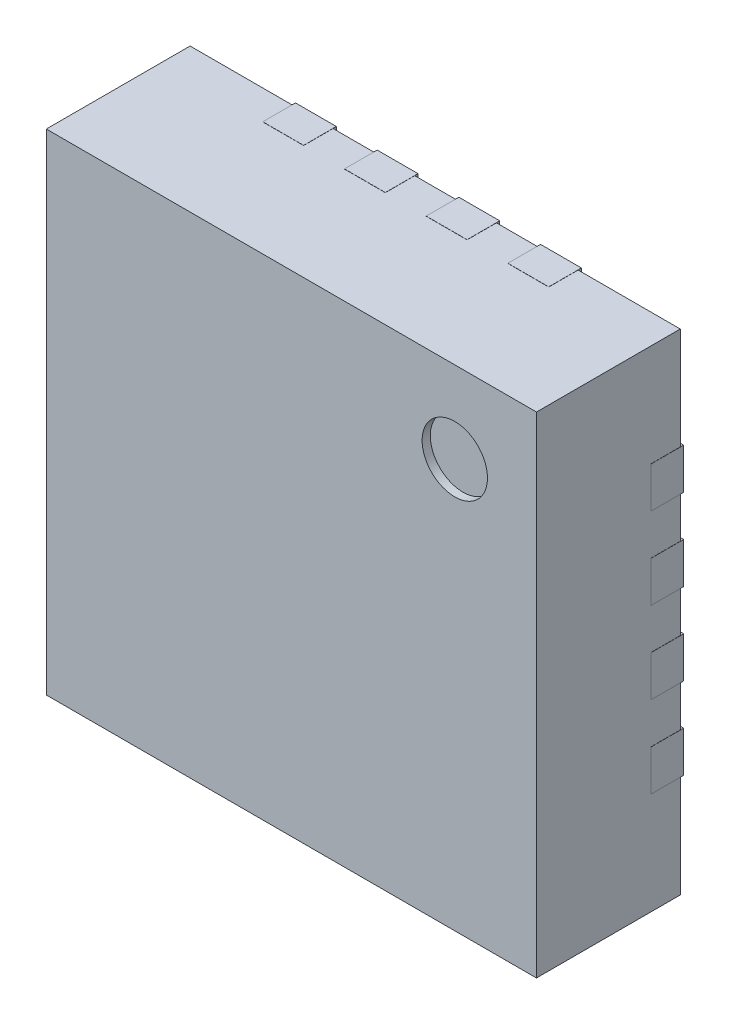
from build123d import *

# Parameters (mm, degrees)
SKETCH1_W      = 3
SKETCH1_H      = 3
EXTRUDE1_DEPTH = 0.88
SKETCH2_W      = 0.25
SKETCH2_H      = 0.401
SKETCH2_W_2    = 0.401
SKETCH2_H_2    = 0.25
EXTRUDE2_DEPTH = 0.2
SKETCH3_R      = 0.2
EXTRUDE3_DEPTH = 0.05


with BuildPart() as part:
    # Sketch1 → Extrude1 (new body)
    with BuildSketch(Plane.XY.offset(0.02)):
        Rectangle(SKETCH1_W, SKETCH1_H)
    extrude(amount=EXTRUDE1_DEPTH)

    # Sketch2 → Extrude2 (add)
    with BuildSketch(Plane.XY):
        Polygon((0.6, 0.9), (0.9, 0.6), (0.9, -0.9), (-0.9, -0.9), (-0.9, 0.9), align=None)
        Polygon((0.825, 1.1), (0.875, 1.15), (0.875, 1.501), (0.625, 1.501), (0.625, 1.1), align=None)
        Polygon((-0.875, 1.15), (-0.825, 1.1), (-0.625, 1.1), (-0.625, 1.501), (-0.875, 1.501), align=None)
        with Locations((-0.25, 1.3005)):
            Rectangle(SKETCH2_W, SKETCH2_H)
        with Locations((0.25, 1.3005)):
            Rectangle(SKETCH2_W, SKETCH2_H)
        Polygon((-1.501, 0.625), (-1.501, 0.875), (-1.15, 0.875), (-1.1, 0.825), (-1.1, 0.625), align=None)
        Polygon((0.875, -1.501), (0.875, -1.15), (0.825, -1.1), (0.625, -1.1), (0.625, -1.501), align=None)
        with Locations((0.25, -1.3005)):
            Rectangle(SKETCH2_W, SKETCH2_H)
        with Locations((-0.25, -1.3005)):
            Rectangle(SKETCH2_W, SKETCH2_H)
        Polygon((-0.625, -1.501), (-0.625, -1.1), (-0.825, -1.1), (-0.875, -1.15), (-0.875, -1.501), align=None)
        Polygon((1.501, -0.625), (1.1, -0.625), (1.1, -0.825), (1.15, -0.875), (1.501, -0.875), align=None)
        Polygon((1.501, 0.625), (1.1, 0.625), (1.1, 0.825), (1.15, 0.875), (1.501, 0.875), align=None)
        with Locations((1.3005, -0.25)):
            Rectangle(SKETCH2_W_2, SKETCH2_H_2)
        with Locations((-1.3005, -0.25)):
            Rectangle(SKETCH2_W_2, SKETCH2_H_2)
        Polygon((-1.501, -0.625), (-1.1, -0.625), (-1.1, -0.825), (-1.15, -0.875), (-1.501, -0.875), align=None)
        with Locations((-1.3005, 0.25)):
            Rectangle(SKETCH2_W_2, SKETCH2_H_2)
        with Locations((1.3005, 0.25)):
            Rectangle(SKETCH2_W_2, SKETCH2_H_2)
    extrude(amount=EXTRUDE2_DEPTH)

    # Sketch3 → Extrude3 (cut)
    with BuildSketch(Plane.XY.offset(0.9)):
        with Locations((1, 1)):
            Circle(SKETCH3_R)
    extrude(amount=-EXTRUDE3_DEPTH, mode=Mode.SUBTRACT)


solid = part.part
